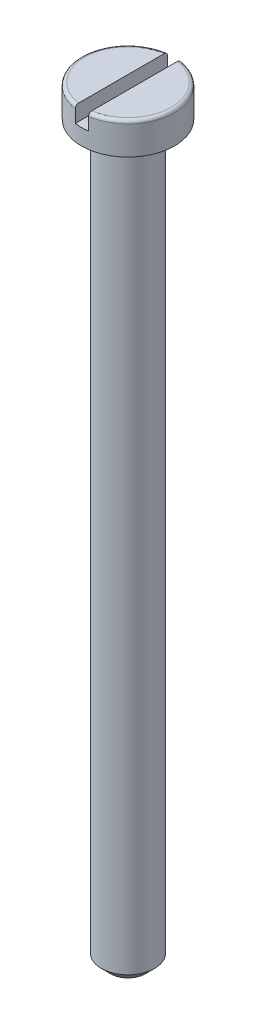
from build123d import *

# Parameters (mm, degrees)
ESQUISSE1_R             = 2
TIGE_DEPTH              = 55
CHANFREIN_D_ENTR_E_SIZE = 0.7
ESQUISSE3_W             = 1
ESQUISSE3_H             = 7
FENTE_DEPTH             = 1.2


with BuildPart() as part:
    # Esquisse1 → Tige (new body)
    with BuildSketch(Plane(origin=(0, 0, 0), x_dir=(1, 0, 0), z_dir=(0, 1, 0))):
        Circle(ESQUISSE1_R)
    extrude(amount=-TIGE_DEPTH)

    # Chanfrein d'entrée
    chanfrein_d_entr_e_edges = [part.edges().sort_by_distance(p)[0] for p in [
        (-2, -55, 0),
    ]]
    chamfer(chanfrein_d_entr_e_edges, length=CHANFREIN_D_ENTR_E_SIZE)

    # Esquisse2 → Tête (revolve)
    with BuildSketch(Plane.XY):
        with BuildLine():
            Line((0, 0), (3.5, 0))
            Line((3.5, 0), (3.5, 2.16))
            ThreePointArc((3.5, 2.16), (3.429705627, 2.329705627), (3.26, 2.4))
            Line((3.26, 2.4), (0, 2.4))
            Line((0, 2.4), (0, 0))
        make_face()
    revolve(axis=Axis((0, 2.4, 0), (0, -1, 0)))

    # Esquisse3 → Fente (cut)
    with BuildSketch(Plane(origin=(0, 2.4, -1.8), x_dir=(1, 0, 0), z_dir=(0, -1, 0))):
        with Locations((0, 1.8)):
            Rectangle(ESQUISSE3_W, ESQUISSE3_H)
    extrude(amount=FENTE_DEPTH, mode=Mode.SUBTRACT)


solid = part.part
